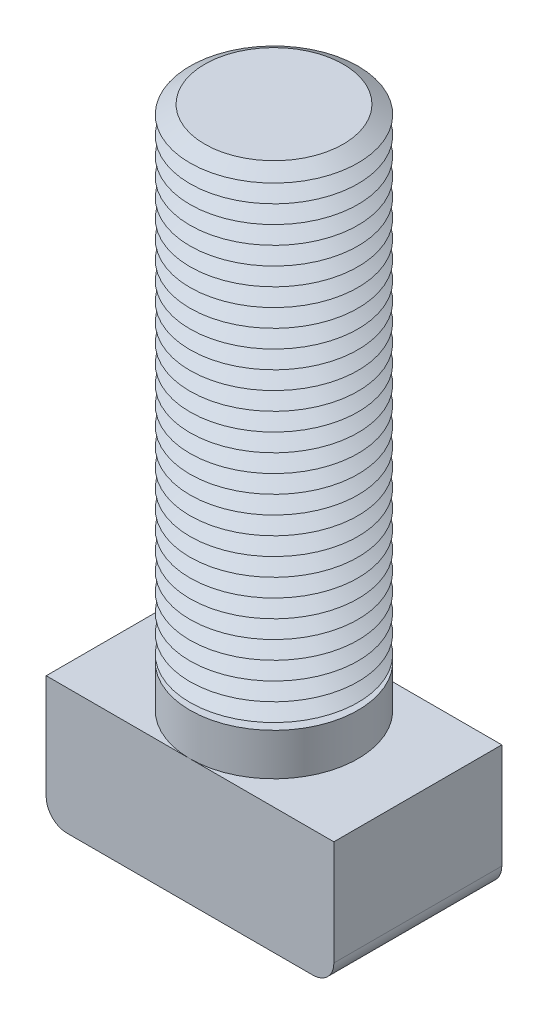
from build123d import *

# Parameters (mm, degrees)
EXTRUDE_1_DEPTH = 4


with BuildPart() as part:
    # 草图1 → 凸台-拉伸1 (new, symmetric)
    with BuildSketch(Plane.XY):
        with BuildLine():
            Line((5.85, -6), (-5.85, -6))
            ThreePointArc((-5.85, -6), (-6.557106781, -5.707106781), (-6.85, -5))
            Line((-6.85, -5), (-6.85, 0))
            Line((-6.85, 0), (6.85, 0))
            Line((6.85, 0), (6.85, -5))
            ThreePointArc((6.85, -5), (6.557106781, -5.707106781), (5.85, -6))
        make_face()
    extrude(amount=EXTRUDE_1_DEPTH, both=True)

    # 草图3 → 旋转1 (revolve)
    with BuildSketch(Plane.XY, mode=Mode.PRIVATE) as revolve_1_sk:
        Polygon((0, 25), (0, 0), (4, 0), (4, 2), (3.475115443, 2), (4, 2.320860647), (3.3, 2.748768937), (4, 3.176677227), (3.3, 3.604585516), (4, 4.032493806), (3.3, 4.460402096), (4, 4.888310385), (3.3, 5.316218675), (4, 5.744126965), (3.3, 6.172035254), (4, 6.599943544), (3.3, 7.027851834), (4, 7.455760123), (3.3, 7.883668413), (4, 8.311576703), (3.3, 8.739484992), (4, 9.167393282), (3.3, 9.595301572), (4, 10.023209861), (3.3, 10.451118151), (4, 10.879026441), (3.3, 11.30693473), (4, 11.73484302), (3.3, 12.16275131), (4, 12.590659599), (3.3, 13.018567889), (4, 13.446476179), (3.3, 13.874384469), (4, 14.302292758), (3.3, 14.730201048), (4, 15.158109338), (3.3, 15.586017627), (4, 16.013925917), (3.3, 16.441834207), (4, 16.869742496), (3.3, 17.297650786), (4, 17.725559076), (3.3, 18.153467365), (4, 18.581375655), (3.3, 19.009283945), (4, 19.437192234), (3.3, 19.865100524), (4, 20.293008814), (3.3, 20.720917103), (4, 21.148825393), (3.3, 21.576733683), (4, 22.004641972), (3.3, 22.432550262), (4, 22.860458552), (3.3, 23.288366841), (4, 23.716275131), (3.3, 24.144183421), (4, 24.57209171), (3.3, 25), align=None)
    revolve(revolve_1_sk.sketch.rotate(Axis((0, 25, 0), (0, 1, 0)), 270), axis=Axis((0, 25, 0), (0, 1, 0)))


solid = part.part
